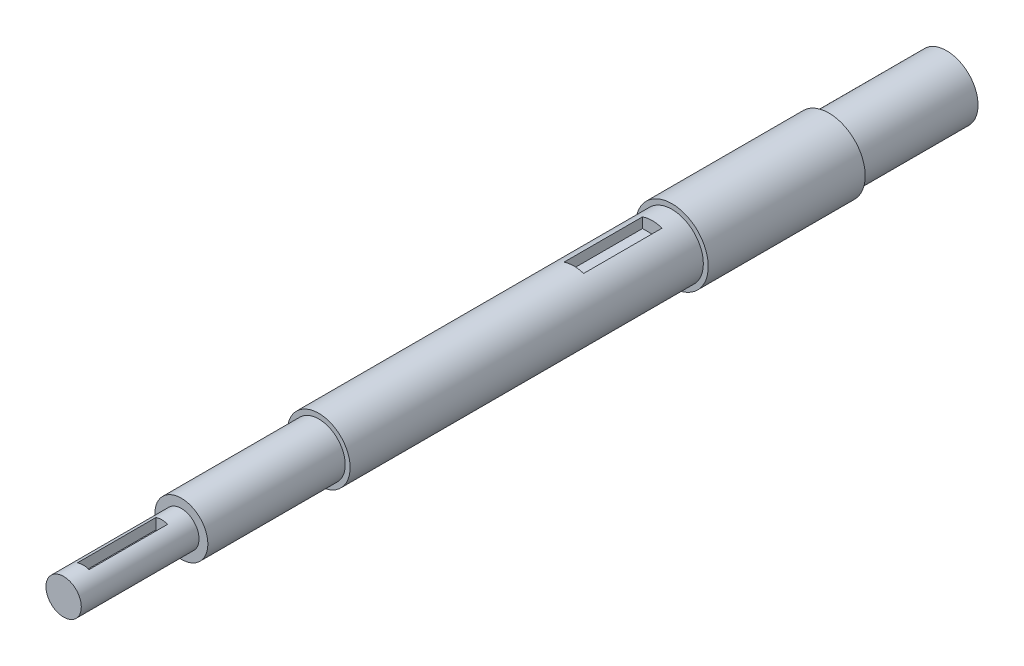
from build123d import *

# Parameters (mm, degrees)
SKETCH1_R           = 9.25
BOSS_EXTRUDE1_DEPTH = 40
SKETCH2_R           = 8
BOSS_EXTRUDE2_DEPTH = 90
BOSS_EXTRUDE3_START = 30
SKETCH3_R           = 8
BOSS_EXTRUDE3_DEPTH = 30
SKETCH4_R           = 6.75
BOSS_EXTRUDE4_DEPTH = 35
SKETCH5_R           = 4.5
BOSS_EXTRUDE5_DEPTH = 30
CUT_EXTRUDE1_START  = -5
SKETCH6_W           = 3
SKETCH6_H           = 6
CUT_EXTRUDE1_DEPTH  = 20
CUT_EXTRUDE2_START  = -65
SKETCH7_W           = 5
SKETCH7_H           = 6
CUT_EXTRUDE2_DEPTH  = 20


with BuildPart() as part:
    # Sketch1 → Boss-Extrude1 (new body)
    with BuildSketch(Plane.XY):
        Circle(SKETCH1_R)
    extrude(amount=BOSS_EXTRUDE1_DEPTH)

    # Sketch2 → Boss-Extrude2 (add)
    with BuildSketch(Plane.XY.offset(40)):
        with Locations(Location((0, 0, 0), (0, 0, 180))):
            Circle(SKETCH2_R)
    extrude(amount=BOSS_EXTRUDE2_DEPTH)

    # Sketch3 → Boss-Extrude3 (add)
    with BuildSketch(Plane(origin=(0, 0, 0), x_dir=(-1, 0, 0), z_dir=(0, 0, -1)).offset(BOSS_EXTRUDE3_START)):
        Circle(SKETCH3_R)
    extrude(amount=-BOSS_EXTRUDE3_DEPTH)

    # Sketch4 → Boss-Extrude4 (add)
    with BuildSketch(Plane.XY.offset(130)):
        Circle(SKETCH4_R)
    extrude(amount=BOSS_EXTRUDE4_DEPTH)

    # Sketch5 → Boss-Extrude5 (add)
    with BuildSketch(Plane.XY.offset(165)):
        Circle(SKETCH5_R)
    extrude(amount=BOSS_EXTRUDE5_DEPTH)

    # Sketch6 → Cut-Extrude1 (cut)
    with BuildSketch(Plane.XY.offset(195).offset(CUT_EXTRUDE1_START)):
        with Locations((0, 4.5)):
            Rectangle(SKETCH6_W, SKETCH6_H)
    extrude(amount=-CUT_EXTRUDE1_DEPTH, mode=Mode.SUBTRACT)

    # Sketch7 → Cut-Extrude2 (cut)
    with BuildSketch(Plane.XY.offset(130).offset(CUT_EXTRUDE2_START)):
        with Locations((0, 8)):
            Rectangle(SKETCH7_W, SKETCH7_H)
    extrude(amount=-CUT_EXTRUDE2_DEPTH, mode=Mode.SUBTRACT)


solid = part.part
